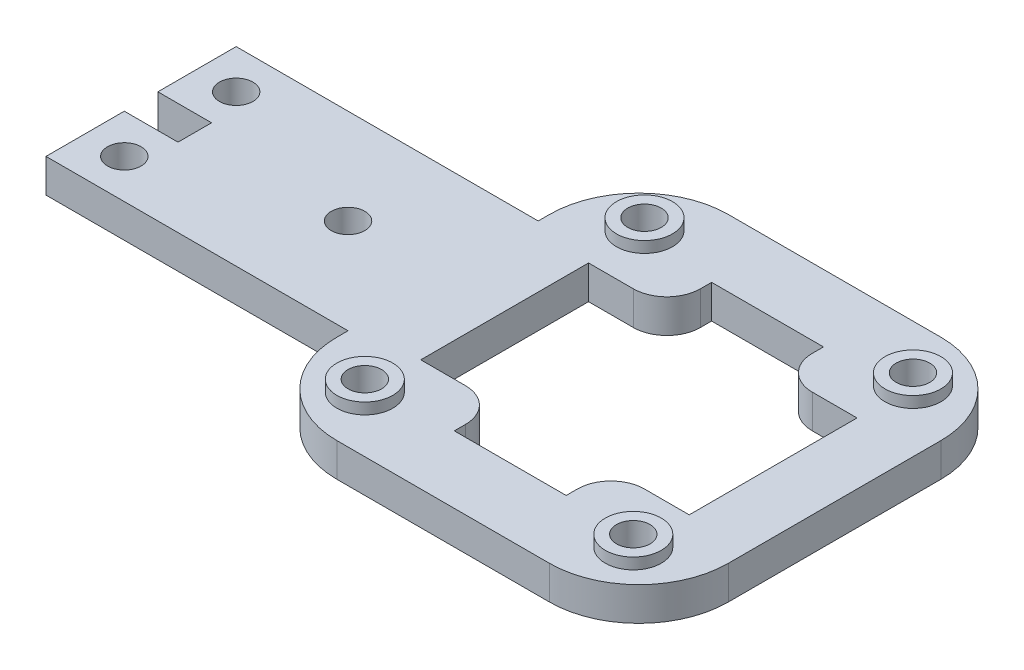
from build123d import *

# Parameters (mm, degrees)
SKETCH_1_R          = 1.5
SKETCH_1_W          = 24
SKETCH_1_H          = 15
EXTRUDE_1_DEPTH     = 3
SKETCH_2_R          = 2.5
SKETCH_2_R_2        = 1.5
EXTRUDE_2_DEPTH     = 1
CUT_EXTRUDE_1_REACH = 41.246
SKETCH_3_W          = 7
SKETCH_3_H          = 3
FILLET_1_R          = 8
EXTRUDE_3_DEPTH     = 3
CUT_EXTRUDE_2_REACH = 41.246
SKETCH_5_R          = 1.5
EXTRUDE_START       = -3
SKETCH_6_R          = 1.5
EXTRUDE_4_DEPTH     = 3
CUT_EXTRUDE_3_DEPTH = 40.246018906
FILLET_2_R          = 3


with BuildPart() as part:
    # 草图1 → 凸台-拉伸1 (new body)
    with BuildSketch(Plane(origin=(0, 0, 0), x_dir=(1, 0, 0), z_dir=(0, 1, 0))):
        Polygon((-14, -8.5), (0, -8.5), (0, -17.5), (35, -17.5), (35, 17.5), (0, 17.5), (0, 8.5), (-14, 8.5), (-21, 8.5), (-21, -8.5), align=None)
        with Locations(Location((-2.5, 0, 0), (0, 0, 270))):
            Circle(SKETCH_1_R, mode=Mode.SUBTRACT)
        with Locations(Location((29.5, -12.5, 0), (0, 0, 270))):
            Circle(SKETCH_1_R, mode=Mode.SUBTRACT)
        with Locations(Location((5.5, -12.5, 0), (0, 0, 270))):
            Circle(SKETCH_1_R, mode=Mode.SUBTRACT)
        with Locations(Location((29.5, 12.5, 0), (0, 0, 270))):
            Circle(SKETCH_1_R, mode=Mode.SUBTRACT)
        with Locations(Location((5.5, 12.5, 0), (0, 0, 270))):
            Circle(SKETCH_1_R, mode=Mode.SUBTRACT)
        with Locations(Location((-17.5, -5, 0), (0, 0, 270))):
            Circle(SKETCH_1_R, mode=Mode.SUBTRACT)
        with Locations(Location((-17.5, 5, 0), (0, 0, 270))):
            Circle(SKETCH_1_R, mode=Mode.SUBTRACT)
        with Locations((17.5, 0)):
            Rectangle(SKETCH_1_W, SKETCH_1_H, mode=Mode.SUBTRACT)
    extrude(amount=EXTRUDE_1_DEPTH)

    # 草图2 → 凸台-拉伸2 (add)
    # profile 1 of 4: a face of its own
    with BuildSketch(Plane(origin=(0, 3, 0), x_dir=(1, 0, 0), z_dir=(0, 1, 0))):
        with Locations(Location((5.5, 12.5, 0), (0, 0, 270))):
            Circle(SKETCH_2_R)
        with Locations(Location((5.5, 12.5, 0), (0, 0, 270))):
            Circle(SKETCH_2_R_2, mode=Mode.SUBTRACT)
    # profile 2 of 4: a face of its own
    with BuildSketch(Plane(origin=(0, 3, 0), x_dir=(1, 0, 0), z_dir=(0, 1, 0))):
        with Locations(Location((29.5, 12.5, 0), (0, 0, 270))):
            Circle(SKETCH_2_R)
        with Locations(Location((29.5, 12.5, 0), (0, 0, 270))):
            Circle(SKETCH_2_R_2, mode=Mode.SUBTRACT)
    # profile 3 of 4: a face of its own
    with BuildSketch(Plane(origin=(0, 3, 0), x_dir=(1, 0, 0), z_dir=(0, 1, 0))):
        with Locations(Location((29.5, -12.5, 0), (0, 0, 270))):
            Circle(SKETCH_2_R)
        with Locations(Location((29.5, -12.5, 0), (0, 0, 270))):
            Circle(SKETCH_2_R_2, mode=Mode.SUBTRACT)
    # profile 4 of 4: a face of its own
    with BuildSketch(Plane(origin=(0, 3, 0), x_dir=(1, 0, 0), z_dir=(0, 1, 0))):
        with Locations(Location((5.5, -12.5, 0), (0, 0, 270))):
            Circle(SKETCH_2_R)
        with Locations(Location((5.5, -12.5, 0), (0, 0, 270))):
            Circle(SKETCH_2_R_2, mode=Mode.SUBTRACT)
    extrude(amount=EXTRUDE_2_DEPTH)

    # 草图3 → 切除-拉伸1 (cut, up to next)
    with BuildSketch(Plane(origin=(0, 3, 0), x_dir=(1, 0, 0), z_dir=(0, 1, 0)), mode=Mode.PRIVATE) as cut_extrude_1_sk1:
        with Locations((-17.5, 0)):
            Rectangle(SKETCH_3_W, SKETCH_3_H)
    cut_extrude_1_tool1 = extrude(cut_extrude_1_sk1.sketch, amount=-CUT_EXTRUDE_1_REACH, mode=Mode.PRIVATE) & part.part
    add(cut_extrude_1_tool1.solids().sort_by_distance((-17.5, 3, 0))[0], mode=Mode.SUBTRACT)

    # 圆角1
    fillet_1_edges = [part.edges().sort_by_distance(p)[0] for p in [
        (0, 1.5, -17.5),
        (35, 1.5, -17.5),
        (35, 1.5, 17.5),
        (0, 1.5, 17.5),
    ]]
    fillet(fillet_1_edges, radius=FILLET_1_R)

    # 草图4 → 凸台-拉伸3 (add)
    with BuildSketch(Plane(origin=(0, 3, 0), x_dir=(1, 0, 0), z_dir=(0, 1, 0))):
        Polygon((-21, 8.5), (-27, 8.5), (-27, 1.5), (-22.2, 1.5), (-22.2, -1.5), (-27, -1.5), (-27, -8.5), (-21, -8.5), (-21, -1.5), (-14, -1.5), (-14, 1.5), (-21, 1.5), align=None)
    extrude(amount=-EXTRUDE_3_DEPTH)

    # 草图5 → 切除-拉伸2 (cut, up to next)
    with BuildSketch(Plane(origin=(0, 3, 0), x_dir=(1, 0, 0), z_dir=(0, 1, 0)), mode=Mode.PRIVATE) as cut_extrude_2_sk1:
        with Locations(Location((-23.5, 5, 0), (0, 0, 270))):
            Circle(SKETCH_5_R)
    cut_extrude_2_tool1 = extrude(cut_extrude_2_sk1.sketch, amount=-CUT_EXTRUDE_2_REACH, mode=Mode.PRIVATE) & part.part
    # 草图5 → 切除-拉伸2 (cut, up to next)
    with BuildSketch(Plane(origin=(0, 3, 0), x_dir=(1, 0, 0), z_dir=(0, 1, 0)), mode=Mode.PRIVATE) as cut_extrude_2_sk2:
        with Locations(Location((-23.5, -5, 0), (0, 0, 270))):
            Circle(SKETCH_5_R)
    cut_extrude_2_tool2 = extrude(cut_extrude_2_sk2.sketch, amount=-CUT_EXTRUDE_2_REACH, mode=Mode.PRIVATE) & part.part
    # 草图5 → 切除-拉伸2 (cut, up to next)
    with BuildSketch(Plane(origin=(0, 3, 0), x_dir=(1, 0, 0), z_dir=(0, 1, 0)), mode=Mode.PRIVATE) as cut_extrude_2_sk3:
        with Locations(Location((-8.5, 0, 0), (0, 0, 270))):
            Circle(SKETCH_5_R)
    cut_extrude_2_tool3 = extrude(cut_extrude_2_sk3.sketch, amount=-CUT_EXTRUDE_2_REACH, mode=Mode.PRIVATE) & part.part
    add(cut_extrude_2_tool1.solids().sort_by_distance((-23.5, 3, -5))[0], mode=Mode.SUBTRACT)
    add(cut_extrude_2_tool2.solids().sort_by_distance((-23.5, 3, 5))[0], mode=Mode.SUBTRACT)
    add(cut_extrude_2_tool3.solids().sort_by_distance((-8.5, 3, 0))[0], mode=Mode.SUBTRACT)

    # 草图6 → 凸台-拉伸4 (add)
    with BuildSketch(Plane(origin=(0, 3, 0), x_dir=(1, 0, 0), z_dir=(0, 1, 0)).offset(EXTRUDE_START)):
        with Locations((-17.5, 5)):
            Circle(SKETCH_6_R)
        with Locations((-2.5, 0)):
            Circle(SKETCH_6_R)
        with Locations((-17.5, -5)):
            Circle(SKETCH_6_R)
    extrude(amount=EXTRUDE_4_DEPTH)

    # 草图7 → 切除-拉伸3 (cut, through all)
    with BuildSketch(Plane(origin=(0, 3, 0), x_dir=(1, 0, 0), z_dir=(0, 1, 0))):
        Polygon((17.5, 11.5), (12.5, 11.5), (12.5, 7.5), (22.5, 7.5), (22.5, 11.5), align=None)
        Polygon((22.5, -11.5), (17.5, -11.5), (12.5, -11.5), (12.5, -7.5), (22.5, -7.5), align=None)
    extrude(amount=-CUT_EXTRUDE_3_DEPTH, mode=Mode.SUBTRACT)

    # 圆角2
    fillet_2_edges = [part.edges().sort_by_distance(p)[0] for p in [
        (22.5, 1.5, -7.5),
        (12.5, 1.5, -7.5),
        (22.5, 1.5, 7.5),
        (12.5, 1.5, 7.5),
    ]]
    fillet(fillet_2_edges, radius=FILLET_2_R)


solid = part.part
